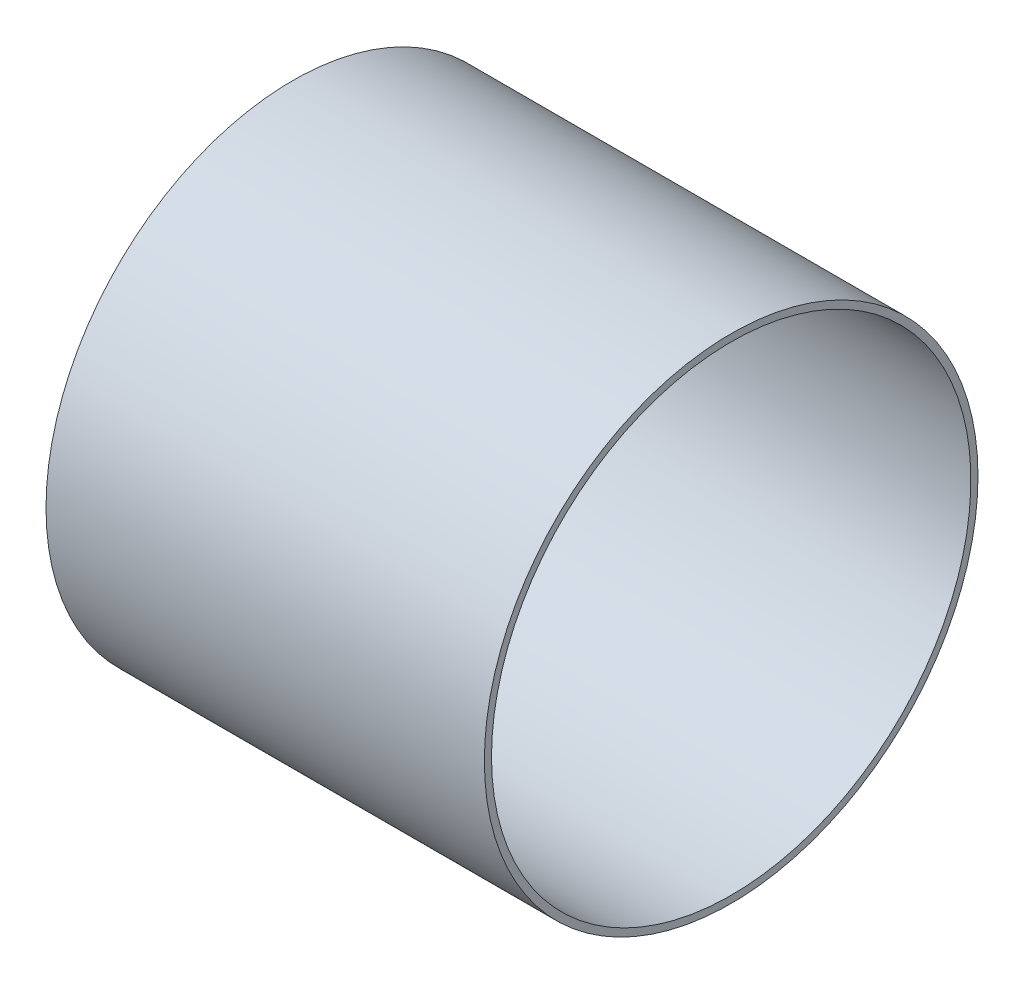
from build123d import *

# Parameters (mm, degrees)
SKETCH1_R           = 57.15
SKETCH1_R_2         = 55.499
BOSS_EXTRUDE1_DEPTH = 101.50094


with BuildPart() as part:
    # Sketch1 → Boss-Extrude1 (new body)
    with BuildSketch(Plane(origin=(0, 0, 0), x_dir=(0, 0, -1), z_dir=(1, 0, 0))):
        with Locations(Location((0, 0, 0), (0, 0, 180))):
            Circle(SKETCH1_R)
        with Locations(Location((0, 0, 0), (0, 0, 180))):
            Circle(SKETCH1_R_2, mode=Mode.SUBTRACT)
    extrude(amount=BOSS_EXTRUDE1_DEPTH)


solid = part.part
